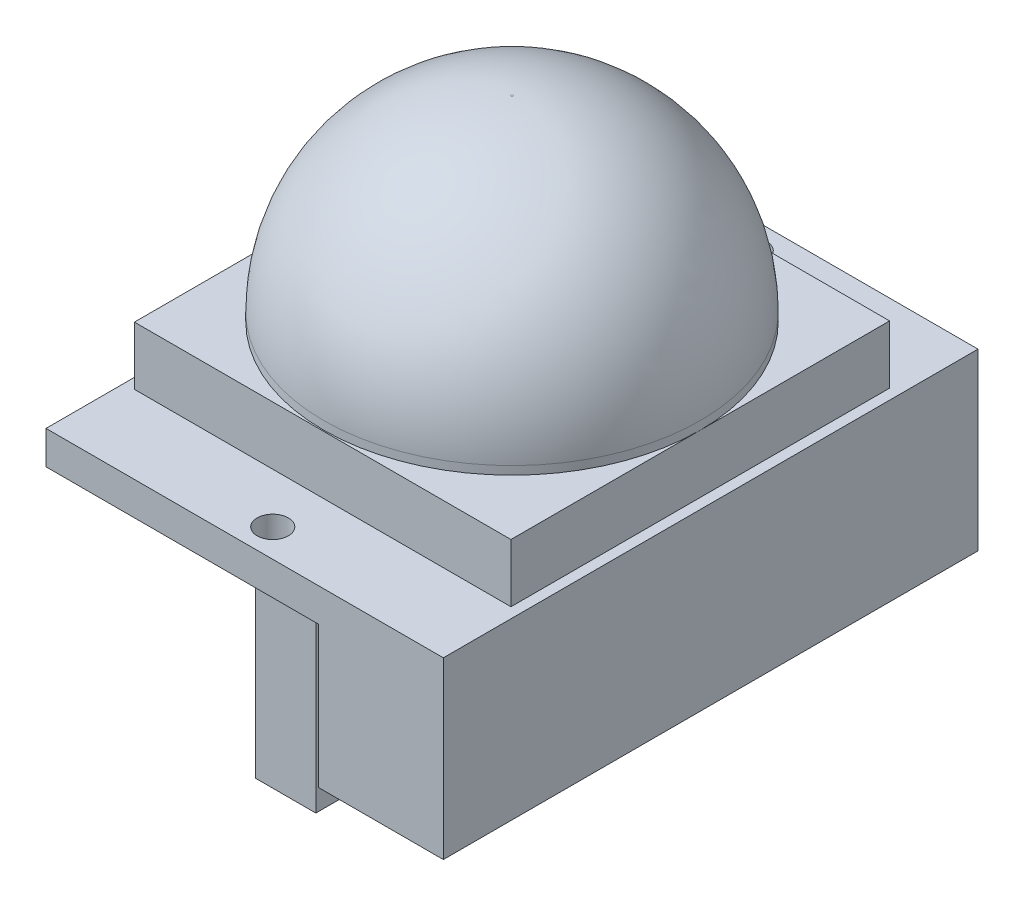
from build123d import *

# Parameters (mm, degrees)
SKETCH1_W           = 24.257
SKETCH1_H           = 32.639
BOSS_EXTRUDE1_DEPTH = 2.032
SKETCH2_R           = 0.9525
CUT_EXTRUDE1_DEPTH  = 2.4892
SKETCH3_W           = 22.987
SKETCH3_H           = 23.114
BOSS_EXTRUDE2_DEPTH = 3.556
SKETCH4_R           = 11.4935
BOSS_EXTRUDE3_DEPTH = 11.938
FILLET1_R           = 11.43
SKETCH5_W           = 7.62
SKETCH5_H           = 32.639
BOSS_EXTRUDE4_DEPTH = 8.636
SKETCH6_W           = 3.683
SKETCH6_H           = 7.62
BOSS_EXTRUDE5_DEPTH = 22.86


with BuildPart() as part:
    # Sketch1 → Boss-Extrude1 (new body)
    with BuildSketch(Plane(origin=(0, 0, 0), x_dir=(1, 0, 0), z_dir=(0, 1, 0))):
        Rectangle(SKETCH1_W, SKETCH1_H)
    extrude(amount=BOSS_EXTRUDE1_DEPTH)

    # Sketch2 → Cut-Extrude1 (cut)
    with BuildSketch(Plane(origin=(0, 2.032, 0), x_dir=(1, 0, 0), z_dir=(0, 1, 0))):
        with Locations(Location((0, 14.605, 0), (0, 0, 270))):
            Circle(SKETCH2_R)
        with Locations(Location((0, -14.605, 0), (0, 0, 270))):
            Circle(SKETCH2_R)
    extrude(amount=-CUT_EXTRUDE1_DEPTH, mode=Mode.SUBTRACT)

    # Sketch3 → Boss-Extrude2 (add)
    with BuildSketch(Plane(origin=(0, 2.032, 0), x_dir=(1, 0, 0), z_dir=(0, 1, 0))):
        Rectangle(SKETCH3_W, SKETCH3_H)
    extrude(amount=BOSS_EXTRUDE2_DEPTH)

    # Sketch4 → Boss-Extrude3 (add)
    with BuildSketch(Plane(origin=(0, 5.588, 0), x_dir=(1, 0, 0), z_dir=(0, 1, 0))):
        with Locations(Location((0, 0, 0), (0, 0, 180))):
            Circle(SKETCH4_R)
    extrude(amount=BOSS_EXTRUDE3_DEPTH)

    # Fillet1
    fillet1_edges = [part.edges().sort_by_distance(p)[0] for p in [
        (11.4935, 17.526, 0),
    ]]
    fillet(fillet1_edges, radius=FILLET1_R)

    # Sketch5 → Boss-Extrude4 (add)
    with BuildSketch(Plane.XZ):
        with Locations((8.3185, 0)):
            Rectangle(SKETCH5_W, SKETCH5_H)
    extrude(amount=BOSS_EXTRUDE4_DEPTH)

    # Sketch6 → Boss-Extrude5 (add)
    with BuildSketch(Plane.XZ):
        with Locations((-10.287, -0.28087532)):
            Rectangle(SKETCH6_W, SKETCH6_H)
    extrude(amount=BOSS_EXTRUDE5_DEPTH)


solid = part.part
